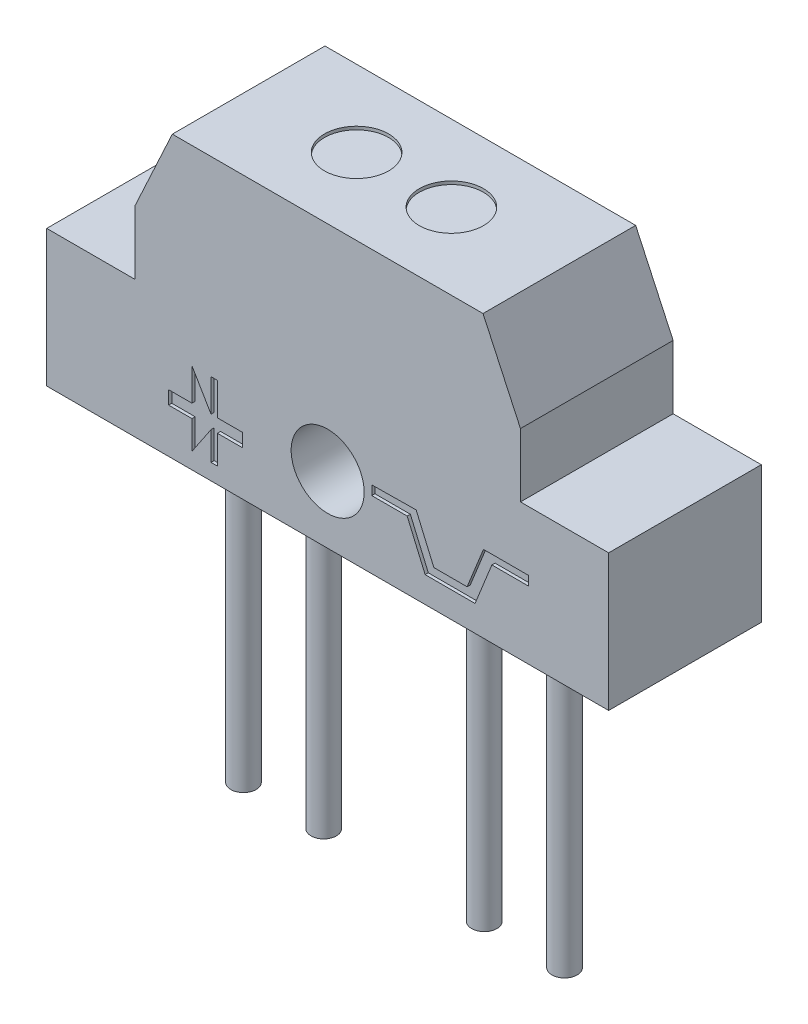
from build123d import *

# Parameters (mm, degrees)
SKETCH_1_W          = 17.78
SKETCH_1_H          = 4.83
EXTRUDE_1_DEPTH     = 4.32
SKETCH_2_W          = 12.2
SKETCH_2_H          = 4.83
EXTRUDE_2_DEPTH     = 2.01
SKETCH_3_W          = 9.83
SKETCH_3_H          = 4.83
EXTRUDE_3_DEPTH     = 2.56
EXTRUDE_4_DEPTH     = 4.83
SKETCH_5_R          = 1.155
CUT_EXTRUDE_1_DEPTH = 14.46822557
CUT_EXTRUDE_2_DEPTH = 0.1
SKETCH_7_R          = 0.4
EXTRUDE_5_DEPTH     = 10.16
SKETCH_8_R          = 1.015
CUT_EXTRUDE_3_DEPTH = 0.1
SKETCH_9_W          = 0.371794872
SKETCH_9_H          = 0.115384615
CUT_EXTRUDE_4_DEPTH = 0.1


with BuildPart() as part:
    # Эскиз1 → Бобышка-Вытянуть1 (new body)
    with BuildSketch(Plane(origin=(0, 0, 0), x_dir=(1, 0, 0), z_dir=(0, 1, 0))):
        Rectangle(SKETCH_1_W, SKETCH_1_H)
    extrude(amount=EXTRUDE_1_DEPTH)

    # Эскиз2 → Бобышка-Вытянуть2 (add)
    with BuildSketch(Plane(origin=(0, 4.32, 0), x_dir=(1, 0, 0), z_dir=(0, 1, 0))):
        Rectangle(SKETCH_2_W, SKETCH_2_H)
    extrude(amount=EXTRUDE_2_DEPTH)

    # Эскиз3 → Бобышка-Вытянуть3 (add)
    with BuildSketch(Plane(origin=(0, 6.33, 0), x_dir=(1, 0, 0), z_dir=(0, 1, 0))):
        Rectangle(SKETCH_3_W, SKETCH_3_H)
    extrude(amount=EXTRUDE_3_DEPTH)

    # Эскиз4 → Бобышка-Вытянуть4 (add)
    with BuildSketch(Plane.XY.offset(2.415)):
        Polygon((-4.915, 8.89), (-6.1, 6.33), (-4.915, 6.33), align=None)
        Polygon((4.915, 8.89), (4.915, 6.33), (6.1, 6.33), align=None)
    extrude(amount=-EXTRUDE_4_DEPTH)

    # Эскиз5 → Вырез-Вытянуть1 (cut, through all)
    with BuildSketch(Plane.XY.offset(2.415)):
        with Locations((0, 2.11)):
            Circle(SKETCH_5_R)
    extrude(amount=-CUT_EXTRUDE_1_DEPTH, mode=Mode.SUBTRACT)

    # Эскиз6 → Вырез-Вытянуть2 (cut)
    with BuildSketch(Plane.XY.offset(2.415)):
        Polygon((-5.030087969, 1.828968487), (-5.030087969, 1.406734825), (-4.295768558, 1.406734825), (-4.295768558, 0.507193546), (-3.689955043, 1.406734825), (-3.689955043, 0.507193546), (-3.488017205, 0.507193546), (-3.488017205, 1.406734825), (-2.698623837, 1.406734825), (-2.698623837, 1.828968487), (-3.488017205, 1.828968487), (-3.488017205, 2.857015663), (-3.689955043, 2.857015663), (-3.689955043, 1.828968487), (-4.295768558, 2.857015663), (-4.295768558, 1.828968487), align=None)
        Polygon((1.395206882, 2.434782002), (1.395206882, 2.141054237), (2.515043985, 2.141054237), (3.084141529, 0.819279296), (4.662928263, 0.819279296), (5.195309837, 2.141054237), (6.35186291, 2.141054237), (6.35186291, 2.434782002), (4.92911905, 2.434782002), (4.411979937, 1.15085041), (3.359511308, 1.15085041), (2.799592757, 2.4513064), align=None)
    extrude(amount=-CUT_EXTRUDE_2_DEPTH, mode=Mode.SUBTRACT)

    # Эскиз7 → Бобышка-Вытянуть5 (add)
    with BuildSketch(Plane.XZ):
        with Locations(Location((5.08, 0, 0), (0, 0, 90))):
            Circle(SKETCH_7_R)
        with Locations(Location((2.54, 0, 0), (0, 0, 90))):
            Circle(SKETCH_7_R)
        with Locations(Location((-5.08, 0, 0), (0, 0, 90))):
            Circle(SKETCH_7_R)
        with Locations(Location((-2.54, 0, 0), (0, 0, 90))):
            Circle(SKETCH_7_R)
    extrude(amount=EXTRUDE_5_DEPTH)

    # Эскиз8 → Вырез-Вытянуть3 (cut)
    with BuildSketch(Plane(origin=(0, 8.89, 0), x_dir=(1, 0, 0), z_dir=(0, 1, 0))):
        with Locations(Location((-1.5, 0, 0), (0, 0, 270))):
            Circle(SKETCH_8_R)
        with Locations(Location((1.5, 0, 0), (0, 0, 270))):
            Circle(SKETCH_8_R)
    extrude(amount=-CUT_EXTRUDE_3_DEPTH, mode=Mode.SUBTRACT)

    # Эскиз9 → Вырез-Вытянуть4 (cut)
    # profile 1 of 11: a face of its own
    with BuildSketch(Plane(origin=(0, 0, -2.415), x_dir=(-1, 0, 0), z_dir=(0, 0, -1))):
        Polygon((-3.957311281, 4.035873106), (-3.957311281, 5.035873106), (-3.81628564, 5.035873106), (-3.81628564, 4.625616695), (-3.329106152, 4.625616695), (-3.329106152, 5.035873106), (-3.188080511, 5.035873106), (-3.188080511, 4.035873106), (-3.329106152, 4.035873106), (-3.329106152, 4.51023208), (-3.81628564, 4.51023208), (-3.81628564, 4.035873106), align=None)
    # profile 2 of 11: a face of its own
    with BuildSketch(Plane(origin=(0, 0, -2.415), x_dir=(-1, 0, 0), z_dir=(0, 0, -1))):
        with BuildLine():
            add(Edge.make_bspline(
                [(-3.008593332, 4.522651952), (-3.00824577, 4.54270109), (-3.007568564, 4.581765819), (-3.001241064, 4.638649098), (-2.990966827, 4.692168822), (-2.976278896, 4.742320823), (-2.957661902, 4.789183688), (-2.935029389, 4.832863532), (-2.907700587, 4.872865931), (-2.876784747, 4.90957168), (-2.842253174, 4.942022253), (-2.805486863, 4.970843011), (-2.766026719, 4.99488293), (-2.724237323, 5.014731978), (-2.679941131, 5.029971502), (-2.633262511, 5.040640556), (-2.584251387, 5.047523132), (-2.550751137, 5.048297789), (-2.533633396, 5.048693619)],
                knots=[0, 0, 0, 0, 1.203621547, 2.345195544, 3.432004029, 4.472479546, 5.478447225, 6.455936844, 7.420185704, 8.381829745, 9.332027588, 10.260832629, 11.182364398, 12.100723901, 13.034044877, 13.989196293, 14.972532542, 16, 16, 16, 16], degree=3))
            add(Edge.make_bspline(
                [(-2.533633396, 5.048693619), (-2.52234307, 5.048496468), (-2.499922523, 5.048104963), (-2.466775747, 5.045126133), (-2.434480726, 5.039809438), (-2.403069263, 5.032684471), (-2.372455856, 5.023336823), (-2.342622223, 5.012302209), (-2.313829525, 4.998628769), (-2.28588621, 4.983319992), (-2.25912213, 4.966196463), (-2.233969315, 4.947280136), (-2.210488013, 4.926714073), (-2.188362807, 4.904836325), (-2.168331984, 4.880908547), (-2.14956802, 4.855659622), (-2.132610108, 4.828641845), (-2.117398078, 4.800076581), (-2.103796977, 4.770405015), (-2.09217221, 4.739504171), (-2.082190235, 4.707744725), (-2.073834479, 4.674938696), (-2.067838999, 4.6410973), (-2.063064734, 4.606366355), (-2.060551906, 4.570632348), (-2.060102793, 4.54649339), (-2.059875383, 4.534270542)],
                knots=[0, 0, 0, 0, 1.034375294, 2.054082248, 3.045783978, 4.031219655, 5.002789406, 5.976610191, 6.94273282, 7.920236376, 8.894345378, 9.851183672, 10.800797181, 11.752517031, 12.698794154, 13.65688337, 14.632873302, 15.61821402, 16.620222298, 17.621258913, 18.640965868, 19.669244166, 20.720417492, 21.788124603, 22.880008887, 24, 24, 24, 24], degree=3))
            add(Edge.make_bspline(
                [(-2.059875383, 4.534270542), (-2.06008374, 4.521846138), (-2.060495385, 4.497299586), (-2.063280744, 4.461036818), (-2.068178372, 4.42581508), (-2.074674242, 4.391529345), (-2.08337851, 4.35825099), (-2.093722194, 4.325884604), (-2.106233465, 4.294622967), (-2.120363557, 4.264390732), (-2.136351749, 4.235603698), (-2.15398781, 4.208463157), (-2.173284234, 4.183222987), (-2.19394791, 4.159573556), (-2.21646139, 4.13793776), (-2.240547451, 4.118113288), (-2.266113483, 4.099913173), (-2.293245373, 4.083830332), (-2.321456204, 4.069733147), (-2.350187728, 4.057226404), (-2.379461287, 4.046560155), (-2.409376928, 4.037916221), (-2.439853046, 4.031384243), (-2.470803876, 4.026493028), (-2.50233088, 4.02367665), (-2.523545218, 4.023261681), (-2.534234358, 4.023052593)],
                knots=[0, 0, 0, 0, 1.141429366, 2.255090526, 3.338676798, 4.407031443, 5.458968682, 6.496860253, 7.526652771, 8.550250826, 9.560787671, 10.54935636, 11.521089193, 12.477323897, 13.431786008, 14.386110112, 15.340986122, 16.312041, 17.28047646, 18.236612773, 19.189437236, 20.140779471, 21.09494583, 22.051062463, 23.018000708, 24, 24, 24, 24], degree=3))
            add(Edge.make_bspline(
                [(-2.534234358, 4.023052593), (-2.545727556, 4.023222636), (-2.568492705, 4.023559449), (-2.602140208, 4.026921419), (-2.634950614, 4.032050221), (-2.666828537, 4.039454662), (-2.697730418, 4.049114278), (-2.72769282, 4.060805972), (-2.756821124, 4.074373487), (-2.784753897, 4.090205307), (-2.811396066, 4.107808588), (-2.836489406, 4.127095826), (-2.860020042, 4.147889273), (-2.881610402, 4.170532617), (-2.901959731, 4.194205031), (-2.920254371, 4.219786402), (-2.937091797, 4.246696572), (-2.951973762, 4.275194943), (-2.965417389, 4.304434652), (-2.976743936, 4.334425052), (-2.986697775, 4.364724163), (-2.994625001, 4.395518738), (-3.000942035, 4.426737739), (-3.005189782, 4.458329221), (-3.008257538, 4.490340231), (-3.008480837, 4.511827177), (-3.008593332, 4.522651952)],
                knots=[0, 0, 0, 0, 1.072727997, 2.12480551, 3.153819198, 4.171534612, 5.177148798, 6.173931848, 7.17235114, 8.174500385, 9.168706755, 10.151274001, 11.127173509, 12.097141049, 13.070188938, 14.039134204, 15.03036519, 16.031505612, 17.038625933, 18.033164522, 19.022845559, 20.014762458, 21.000193215, 21.994692725, 22.989758729, 24, 24, 24, 24], degree=3))
        make_face()
        with BuildLine():
            add(Edge.make_bspline(
                [(-2.867567691, 4.521049388), (-2.867351576, 4.506612199), (-2.866930167, 4.478460701), (-2.862109017, 4.437417313), (-2.854793693, 4.398690787), (-2.84471029, 4.362172407), (-2.831155728, 4.328223335), (-2.814949494, 4.296517353), (-2.79554592, 4.267265225), (-2.773373107, 4.240548781), (-2.748985555, 4.216548729), (-2.722924981, 4.19558596), (-2.695185526, 4.178031125), (-2.666074731, 4.16353586), (-2.635383508, 4.152220984), (-2.603203777, 4.144275964), (-2.569511894, 4.139306998), (-2.546538185, 4.13873075), (-2.534835319, 4.138437208)],
                knots=[0, 0, 0, 0, 1.215430442, 2.370003584, 3.475209778, 4.53279855, 5.55522989, 6.548792651, 7.526809858, 8.505409025, 9.467826767, 10.404123909, 11.316848639, 12.227335424, 13.138360512, 14.065900994, 15.014765094, 16, 16, 16, 16], degree=3))
            add(Edge.make_bspline(
                [(-2.534835319, 4.138437208), (-2.52293409, 4.138735092), (-2.499631516, 4.139318348), (-2.465431682, 4.144200571), (-2.432938011, 4.152512347), (-2.401828433, 4.163577205), (-2.37266538, 4.178535006), (-2.344766809, 4.19605051), (-2.318893241, 4.217453953), (-2.294409552, 4.241496452), (-2.272449333, 4.268825167), (-2.252964261, 4.298766905), (-2.23713596, 4.331770717), (-2.223470358, 4.367109574), (-2.213463617, 4.405451393), (-2.206068022, 4.446360305), (-2.20161128, 4.489967901), (-2.201141963, 4.519903707), (-2.200901024, 4.535272144)],
                knots=[0, 0, 0, 0, 0.976878588, 1.912725521, 2.8289017, 3.727303729, 4.617335839, 5.514666588, 6.426584173, 7.368641557, 8.327632997, 9.299405846, 10.294892156, 11.327373912, 12.405931897, 13.542618837, 14.738430195, 16, 16, 16, 16], degree=3))
            add(Edge.make_bspline(
                [(-2.200901024, 4.535272144), (-2.200986172, 4.545159196), (-2.2011532, 4.564554015), (-2.203365219, 4.5931422), (-2.206218439, 4.620841128), (-2.210562511, 4.647615058), (-2.216549193, 4.673353114), (-2.22318142, 4.69825124), (-2.231474789, 4.722094877), (-2.240884771, 4.74497753), (-2.251414381, 4.766781726), (-2.263290382, 4.787323645), (-2.276374749, 4.806523425), (-2.29031445, 4.824745075), (-2.305881388, 4.841283343), (-2.322326006, 4.856836811), (-2.340021841, 4.871084143), (-2.358792297, 4.884029059), (-2.37837109, 4.895681524), (-2.398717859, 4.905654522), (-2.41950845, 4.914414547), (-2.441090869, 4.921129475), (-2.463167103, 4.926545162), (-2.485826398, 4.930658881), (-2.509152858, 4.932789157), (-2.524882347, 4.933134477), (-2.532832114, 4.933309003)],
                knots=[0, 0, 0, 0, 1.220438779, 2.394059227, 3.538503547, 4.658058814, 5.74010225, 6.800155734, 7.837851593, 8.854470756, 9.853724944, 10.825214244, 11.781044712, 12.72106398, 13.654479919, 14.581868691, 15.514082315, 16.456304431, 17.39516604, 18.324312202, 19.252140633, 20.177768678, 21.111585046, 22.057694709, 23.018348693, 24, 24, 24, 24], degree=3))
            add(Edge.make_bspline(
                [(-2.532832114, 4.933309003), (-2.544068025, 4.933085862), (-2.566237729, 4.932645581), (-2.598874173, 4.927751168), (-2.630339243, 4.920438245), (-2.66068177, 4.91021439), (-2.689642239, 4.8966764), (-2.717370693, 4.880073907), (-2.74411326, 4.860858971), (-2.76944825, 4.838563426), (-2.793066002, 4.812951287), (-2.813032442, 4.78275536), (-2.829860703, 4.748696485), (-2.843911991, 4.710860993), (-2.854625685, 4.668955874), (-2.862030187, 4.623161465), (-2.866705238, 4.57342951), (-2.867272857, 4.538955795), (-2.867567691, 4.521049388)],
                knots=[0, 0, 0, 0, 0.895090134, 1.766112571, 2.624765742, 3.468151641, 4.313618154, 5.168136083, 6.041303099, 6.935189387, 7.854749729, 8.809996334, 9.809869957, 10.877771942, 12.021723904, 13.25217762, 14.572720513, 16, 16, 16, 16], degree=3))
        make_face(mode=Mode.SUBTRACT)
    # profile 3 of 11: a face of its own
    with BuildSketch(Plane(origin=(0, 0, -2.415), x_dir=(-1, 0, 0), z_dir=(0, 0, -1))):
        Polygon((-2.017207114, 4.035873106), (-1.620171858, 5.035873106), (-1.46111737, 5.035873106), (-1.064082114, 4.035873106), (-1.213721537, 4.035873106), (-1.327503588, 4.343565413), (-1.75378564, 4.343565413), (-1.867567691, 4.035873106), align=None)
        with BuildLine():
            Line((-1.711317691, 4.458950029), (-1.369971537, 4.458950029))
            Line((-1.369971537, 4.458950029), (-1.467126986, 4.721770542))
            add(Edge.make_bspline(
                [(-1.467126986, 4.721770542), (-1.470851579, 4.731925568), (-1.478133861, 4.751780562), (-1.488993939, 4.780628193), (-1.49891553, 4.808023086), (-1.508644466, 4.83357244), (-1.51742695, 4.857647384), (-1.52552199, 4.880085302), (-1.533527917, 4.900730241), (-1.538332386, 4.914068998), (-1.540644614, 4.92048849)],
                knots=[0, 0, 0, 0, 1.225184869, 2.395467751, 3.491410812, 4.525364584, 5.492066482, 6.394148129, 7.227157926, 8, 8, 8, 8], degree=3))
            add(Edge.make_bspline(
                [(-1.540644614, 4.92048849), (-1.544469486, 4.904658589), (-1.552135, 4.872933514), (-1.568184721, 4.826452023), (-1.586545045, 4.780395626), (-1.601455815, 4.750717198), (-1.608953909, 4.735792978)],
                knots=[0, 0, 0, 0, 0.9891762, 1.982431084, 2.985436691, 4, 4, 4, 4], degree=3))
            Line((-1.608953909, 4.735792978), (-1.711317691, 4.458950029))
        make_face(mode=Mode.SUBTRACT)
    # profile 4 of 11: a face of its own
    with BuildSketch(Plane(origin=(0, 0, -2.415), x_dir=(-1, 0, 0), z_dir=(0, 0, -1))):
        with BuildLine():
            add(Edge.make_bspline(
                [(-1.008593332, 4.529062208), (-1.008464165, 4.543353126), (-1.008211182, 4.571343016), (-1.00664201, 4.612297254), (-1.003902362, 4.651189797), (-0.999812822, 4.687986871), (-0.99497004, 4.722771532), (-0.988674394, 4.75549414), (-0.981590876, 4.786228113), (-0.973091927, 4.814941416), (-0.963754363, 4.841880931), (-0.953160599, 4.86700344), (-0.941241178, 4.89028231), (-0.928581864, 4.911958953), (-0.914516246, 4.931696209), (-0.899893297, 4.950047987), (-0.883650307, 4.966341255), (-0.866462694, 4.98099524), (-0.848077368, 4.993926527), (-0.828591604, 5.005084669), (-0.808080379, 5.014936504), (-0.78615277, 5.022352962), (-0.763263992, 5.028398948), (-0.739237857, 5.032846448), (-0.714047891, 5.0354684), (-0.69683409, 5.03573668), (-0.688080511, 5.035873106)],
                knots=[0, 0, 0, 0, 1.514747001, 2.966751498, 4.343369068, 5.64627492, 6.890416844, 8.064737671, 9.177176366, 10.232018008, 11.237056675, 12.19799043, 13.119080079, 14.007588942, 14.855863561, 15.685992447, 16.491747269, 17.290132607, 18.077525251, 18.870243746, 19.668095604, 20.485086593, 21.319398728, 22.175900658, 23.072407314, 24, 24, 24, 24], degree=3))
            add(Edge.make_bspline(
                [(-0.688080511, 5.035873106), (-0.675237874, 5.035495541), (-0.650007997, 5.034753801), (-0.613172246, 5.0287043), (-0.578456925, 5.018355696), (-0.545884589, 5.004394982), (-0.516012055, 4.986662189), (-0.489334623, 4.965105278), (-0.466140053, 4.939950591), (-0.446681477, 4.910900055), (-0.429672739, 4.878755076), (-0.414562549, 4.843371376), (-0.400903377, 4.804788608), (-0.391210531, 4.770251643), (-0.384296632, 4.74043811), (-0.37972018, 4.715848751), (-0.375920807, 4.689316695), (-0.373009974, 4.660906129), (-0.370621705, 4.630648918), (-0.368777353, 4.598526224), (-0.367841156, 4.564457762), (-0.367660555, 4.54108191), (-0.367567691, 4.529062208)],
                knots=[0, 0, 0, 0, 1.134486744, 2.228744715, 3.287356444, 4.328707449, 5.352829806, 6.347195599, 7.349461267, 8.364207941, 9.428085653, 10.559314403, 11.761222316, 13.04268526, 13.726896727, 14.465273606, 15.252205015, 16.094778733, 16.988606776, 17.934225168, 18.937792761, 20, 20, 20, 20], degree=3))
            add(Edge.make_bspline(
                [(-0.367567691, 4.529062208), (-0.367699277, 4.514838417), (-0.367956357, 4.487049441), (-0.369483482, 4.446423587), (-0.372388213, 4.407824469), (-0.375962537, 4.371163667), (-0.381369741, 4.336539047), (-0.387196297, 4.3038035), (-0.394402306, 4.273105673), (-0.402810028, 4.244432113), (-0.412279031, 4.217631203), (-0.422663259, 4.192500397), (-0.434164788, 4.169056869), (-0.447125948, 4.147529273), (-0.460953706, 4.127631868), (-0.475749337, 4.109290013), (-0.491826525, 4.092767701), (-0.509169024, 4.07815767), (-0.527425262, 4.064997064), (-0.5469584, 4.053728758), (-0.567682943, 4.044393162), (-0.589460423, 4.036411692), (-0.612511803, 4.030563338), (-0.636655304, 4.026086515), (-0.661979882, 4.023450237), (-0.679260265, 4.02318697), (-0.688080511, 4.023052593)],
                knots=[0, 0, 0, 0, 1.508974709, 2.94807912, 4.311757619, 5.615040294, 6.854280449, 8.028314546, 9.141715822, 10.197470207, 11.196696834, 12.155719058, 13.080757287, 13.963948316, 14.818758719, 15.649605906, 16.461113142, 17.260189315, 18.052359509, 18.845763934, 19.647754795, 20.461145776, 21.303032214, 22.167241874, 23.064524267, 24, 24, 24, 24], degree=3))
            add(Edge.make_bspline(
                [(-0.688080511, 4.023052593), (-0.699644877, 4.023382467), (-0.722192208, 4.024025631), (-0.755120923, 4.028395533), (-0.786026277, 4.036086765), (-0.815168941, 4.046401793), (-0.842221343, 4.060198736), (-0.867312648, 4.076985411), (-0.890947046, 4.096371259), (-0.904552443, 4.111666248), (-0.911437883, 4.11940676)],
                knots=[0, 0, 0, 0, 1.10322584, 2.150986741, 3.161425019, 4.136713905, 5.093944212, 6.049774532, 7.013026876, 8, 8, 8, 8], degree=3))
            add(Edge.make_bspline(
                [(-0.911437883, 4.11940676), (-0.919363183, 4.130839121), (-0.935705491, 4.15441314), (-0.954832746, 4.194609029), (-0.971894595, 4.238859059), (-0.985285019, 4.288031411), (-0.995773059, 4.341734728), (-1.003348042, 4.400074387), (-1.007634737, 4.463025185), (-1.008266587, 4.506552951), (-1.008593332, 4.529062208)],
                knots=[0, 0, 0, 0, 0.779365345, 1.607084704, 2.489375761, 3.438383567, 4.461919411, 5.557722155, 6.737039282, 8, 8, 8, 8], degree=3))
        make_face()
        with BuildLine():
            add(Edge.make_bspline(
                [(-0.880388204, 4.529462849), (-0.880260906, 4.510229212), (-0.880017231, 4.473411776), (-0.877471412, 4.420811717), (-0.873088891, 4.373359283), (-0.867294912, 4.331120177), (-0.859644513, 4.29403726), (-0.850038533, 4.262205033), (-0.839210309, 4.235241435), (-0.825810586, 4.21348066), (-0.81113937, 4.195742454), (-0.795992342, 4.180487023), (-0.780013144, 4.167520257), (-0.763306041, 4.156708617), (-0.745611807, 4.148522755), (-0.727123928, 4.142589623), (-0.707838379, 4.139175197), (-0.694704045, 4.138684608), (-0.688080511, 4.138437208)],
                knots=[0, 0, 0, 0, 1.89448813, 3.626469325, 5.185477471, 6.587276848, 7.82441448, 8.910550357, 9.859733512, 10.6775885, 11.416198291, 12.123144072, 12.791880183, 13.439617036, 14.078171869, 14.70637855, 15.347637704, 16, 16, 16, 16], degree=3))
            add(Edge.make_bspline(
                [(-0.688080511, 4.138437208), (-0.681458637, 4.138690014), (-0.668327591, 4.139191322), (-0.648997482, 4.142530457), (-0.630581534, 4.148769022), (-0.612913683, 4.156925972), (-0.596085147, 4.167491182), (-0.580184428, 4.180506927), (-0.564957609, 4.195753299), (-0.550352295, 4.21369768), (-0.53705466, 4.235559062), (-0.526023311, 4.262500695), (-0.516567035, 4.29438867), (-0.508874657, 4.331452693), (-0.503056777, 4.373625017), (-0.498700753, 4.420945839), (-0.496137897, 4.473478219), (-0.495898243, 4.510229125), (-0.495772819, 4.529462849)],
                knots=[0, 0, 0, 0, 0.652509534, 1.29391342, 1.924290653, 2.562989607, 3.207355802, 3.876242846, 4.583348185, 5.32723334, 6.150888545, 7.094226006, 8.186903555, 9.424320409, 10.81992305, 12.379283064, 14.105084285, 16, 16, 16, 16], degree=3))
            add(Edge.make_bspline(
                [(-0.495772819, 4.529462849), (-0.495894227, 4.548296382), (-0.49612684, 4.584380717), (-0.498755795, 4.635967435), (-0.502875604, 4.682623399), (-0.508510848, 4.724391621), (-0.516000086, 4.761226756), (-0.52508351, 4.793207222), (-0.535907768, 4.820264814), (-0.548777772, 4.842671326), (-0.563104662, 4.861050745), (-0.578070456, 4.876959732), (-0.594049302, 4.890489807), (-0.611324295, 4.901343832), (-0.629338632, 4.910100456), (-0.648506235, 4.916126988), (-0.668638701, 4.9198295), (-0.682455352, 4.920266317), (-0.689482755, 4.92048849)],
                knots=[0, 0, 0, 0, 1.850066095, 3.544656626, 5.0727657, 6.45041401, 7.682899467, 8.762389858, 9.712573485, 10.538438529, 11.291566246, 11.996865408, 12.681389046, 13.341983376, 13.996294293, 14.643563182, 15.31009126, 16, 16, 16, 16], degree=3))
            add(Edge.make_bspline(
                [(-0.689482755, 4.92048849), (-0.696105872, 4.92031466), (-0.709165811, 4.919971888), (-0.728287271, 4.916700134), (-0.746408455, 4.911229033), (-0.763736971, 4.903817895), (-0.779840224, 4.893843966), (-0.795356828, 4.882198695), (-0.809560045, 4.868010233), (-0.818118778, 4.857403159), (-0.822495576, 4.851978875)],
                knots=[0, 0, 0, 0, 1.021318143, 2.013908504, 2.982026795, 3.937174072, 4.91255697, 5.897578595, 6.924855925, 8, 8, 8, 8], degree=3))
            add(Edge.make_bspline(
                [(-0.822495576, 4.851978875), (-0.827260572, 4.844012281), (-0.837323242, 4.827188512), (-0.848582785, 4.797948109), (-0.85852902, 4.764531894), (-0.866718069, 4.726425734), (-0.872642271, 4.683694996), (-0.8773192, 4.636389306), (-0.879748691, 4.584442617), (-0.880169151, 4.548295075), (-0.880388204, 4.529462849)],
                knots=[0, 0, 0, 0, 0.671104906, 1.417232262, 2.260109084, 3.195198885, 4.23592645, 5.382417421, 6.636286093, 8, 8, 8, 8], degree=3))
        make_face(mode=Mode.SUBTRACT)
    # profile 5 of 11: a face of its own
    with BuildSketch(Plane(origin=(0, 0, -2.415), x_dir=(-1, 0, 0), z_dir=(0, 0, -1))):
        with BuildLine():
            Line((0.209355386, 4.035873106), (0.081150258, 4.035873106))
            Line((0.081150258, 4.035873106), (0.081150258, 4.815119901))
            add(Edge.make_bspline(
                [(0.081150258, 4.815119901), (0.073768195, 4.808000809), (0.058425387, 4.793204559), (0.032489991, 4.772264169), (0.003542774, 4.751040196), (-0.028040366, 4.730630974), (-0.060234033, 4.711417892), (-0.091345068, 4.694138679), (-0.120854059, 4.679516272), (-0.14029179, 4.671520682), (-0.149618973, 4.667684003)],
                knots=[0, 0, 0, 0, 0.893362401, 1.856755847, 2.901947673, 4.020460078, 5.132200827, 6.168787962, 7.121294059, 8, 8, 8, 8], degree=3))
            Line((-0.149618973, 4.667684003), (-0.149618973, 4.785873106))
            add(Edge.make_bspline(
                [(-0.149618973, 4.785873106), (-0.133598572, 4.794123644), (-0.102023311, 4.810384967), (-0.057414294, 4.838470507), (-0.015766978, 4.868916389), (0.022229209, 4.901715871), (0.056290369, 4.93524283), (0.084994203, 4.969072849), (0.109011745, 5.001965864), (0.121061801, 5.024905095), (0.126823335, 5.035873106)],
                knots=[0, 0, 0, 0, 1.141258006, 2.249351951, 3.335817539, 4.406819942, 5.426913362, 6.360259544, 7.215985427, 8, 8, 8, 8], degree=3))
            Line((0.126823335, 5.035873106), (0.209355386, 5.035873106))
            Line((0.209355386, 5.035873106), (0.209355386, 4.035873106))
        make_face()
    # profile 6 of 11: a face of its own
    with BuildSketch(Plane(origin=(0, 0, -2.415), x_dir=(-1, 0, 0), z_dir=(0, 0, -1))):
        Polygon((0.914483591, 4.035873106), (0.914483591, 4.279462849), (0.478586155, 4.279462849), (0.478586155, 4.407667978), (0.95294513, 5.023052593), (1.042688719, 5.023052593), (1.042688719, 4.407667978), (1.170893848, 4.407667978), (1.170893848, 4.279462849), (1.042688719, 4.279462849), (1.042688719, 4.035873106), align=None)
        Polygon((0.914483591, 4.407667978), (0.914483591, 4.76784426), (0.63683936, 4.407667978), align=None, mode=Mode.SUBTRACT)
    # profile 7 of 11: a face of its own
    with BuildSketch(Plane(origin=(0, 0, -2.415), x_dir=(-1, 0, 0), z_dir=(0, 0, -1))):
        with BuildLine():
            Line((1.311919489, 4.279462849), (1.440124617, 4.292283362))
            add(Edge.make_bspline(
                [(1.440124617, 4.292283362), (1.441283668, 4.285714636), (1.443524211, 4.273016731), (1.448580412, 4.254920041), (1.45370864, 4.23804663), (1.460328491, 4.222772397), (1.467222584, 4.208682452), (1.475029954, 4.195917987), (1.483889704, 4.184735372), (1.496400834, 4.171631341), (1.514152307, 4.157957062), (1.538758253, 4.146880363), (1.565827105, 4.139432717), (1.584903192, 4.13877663), (1.594772053, 4.138437208)],
                knots=[0, 0, 0, 0, 0.994516507, 1.922484754, 2.80151264, 3.623050913, 4.402748861, 5.140924173, 5.850441436, 6.526872911, 7.841975818, 9.161260782, 10.53140107, 12, 12, 12, 12], degree=3))
            add(Edge.make_bspline(
                [(1.594772053, 4.138437208), (1.603407402, 4.138748175), (1.620403107, 4.139360206), (1.645183407, 4.144104717), (1.668749089, 4.151705325), (1.690689937, 4.162610606), (1.710926099, 4.175882029), (1.728601704, 4.191651152), (1.743952777, 4.209238819), (1.756560776, 4.229503187), (1.767322044, 4.252648496), (1.77749001, 4.278969106), (1.787108738, 4.308918477), (1.795657298, 4.342114614), (1.803312115, 4.377345587), (1.808684191, 4.413813099), (1.811989421, 4.450808165), (1.812343005, 4.4757033), (1.81252045, 4.488196824)],
                knots=[0, 0, 0, 0, 0.897794352, 1.766998465, 2.614902619, 3.466100941, 4.308008728, 5.124841802, 5.922729683, 6.728261092, 7.598214292, 8.574707161, 9.662086263, 10.868425066, 12.139522319, 13.41071447, 14.70057738, 16, 16, 16, 16], degree=3))
            add(Edge.make_bspline(
                [(1.81252045, 4.488196824), (1.812459766, 4.491602418), (1.812314581, 4.499750102), (1.812064841, 4.507895289), (1.811919489, 4.512635926)],
                knots=[0, 0, 0, 0, 0.835966126, 2, 2, 2, 2], degree=3))
            add(Edge.make_bspline(
                [(1.811919489, 4.512635926), (1.805738923, 4.503250288), (1.79338775, 4.484494135), (1.770633839, 4.459321108), (1.744602966, 4.43699229), (1.71569026, 4.417681069), (1.684609644, 4.401832733), (1.651901824, 4.39031669), (1.617848754, 4.383205685), (1.59467278, 4.382422828), (1.582953142, 4.382026952)],
                knots=[0, 0, 0, 0, 0.978840568, 1.956103883, 2.947027447, 3.962820877, 4.980997961, 5.980964245, 6.979013046, 8, 8, 8, 8], degree=3))
            add(Edge.make_bspline(
                [(1.582953142, 4.382026952), (1.573186739, 4.382279989), (1.553961385, 4.382778096), (1.525799625, 4.387205121), (1.498713532, 4.393844088), (1.472959776, 4.403895805), (1.448137666, 4.416327193), (1.424507834, 4.431585769), (1.402033868, 4.449650763), (1.381006169, 4.470297236), (1.361816543, 4.493310433), (1.344893508, 4.518129707), (1.330840642, 4.544876418), (1.319148172, 4.573216727), (1.3101262, 4.60342446), (1.303857111, 4.635428837), (1.299640847, 4.669107688), (1.299281995, 4.692176554), (1.299098976, 4.703942016)],
                knots=[0, 0, 0, 0, 0.975490236, 1.920271282, 2.842894855, 3.757591483, 4.67685385, 5.613562631, 6.563069669, 7.554119451, 8.55387214, 9.553424333, 10.550567425, 11.568071726, 12.613215376, 13.695622473, 14.824733476, 16, 16, 16, 16], degree=3))
            add(Edge.make_bspline(
                [(1.299098976, 4.703942016), (1.299373091, 4.716106027), (1.299909309, 4.739900942), (1.30395979, 4.774692063), (1.310660943, 4.807652321), (1.320433651, 4.838718803), (1.332519223, 4.86809112), (1.34775866, 4.895557502), (1.365565155, 4.921235445), (1.386045099, 4.94487739), (1.408552371, 4.966090758), (1.432448579, 4.985024058), (1.458045108, 5.000587141), (1.484851167, 5.013562869), (1.513069618, 5.023590708), (1.54265223, 5.030838728), (1.573680864, 5.03509164), (1.594825692, 5.035609494), (1.60558936, 5.035873106)],
                knots=[0, 0, 0, 0, 1.151671969, 2.252870106, 3.311924673, 4.331900944, 5.332425074, 6.314476151, 7.300265758, 8.286521684, 9.270545387, 10.225535917, 11.167946231, 12.101233205, 13.04124339, 13.998220545, 14.981004193, 16, 16, 16, 16], degree=3))
            add(Edge.make_bspline(
                [(1.60558936, 5.035873106), (1.613406885, 5.035714999), (1.628945511, 5.035400735), (1.652070211, 5.033001436), (1.674647322, 5.028676308), (1.696824043, 5.023216779), (1.718226315, 5.015638542), (1.739266701, 5.006875087), (1.759691421, 4.996156719), (1.779619489, 4.983968591), (1.798925741, 4.970524947), (1.816688606, 4.955079656), (1.833618055, 4.93868858), (1.849369597, 4.920837291), (1.863445011, 4.901250285), (1.876799872, 4.88062006), (1.888790411, 4.858496456), (1.899724949, 4.834849511), (1.909457113, 4.809192461), (1.917576175, 4.78095831), (1.924536023, 4.750049269), (1.930330783, 4.716424366), (1.934627692, 4.680107575), (1.937789966, 4.641152867), (1.939860171, 4.599530615), (1.940034736, 4.570865004), (1.940124617, 4.556105478)],
                knots=[0, 0, 0, 0, 0.850689348, 1.69088598, 2.526071361, 3.350886897, 4.173587108, 4.994166539, 5.82944675, 6.680632524, 7.535501428, 8.385942454, 9.238956306, 10.098905971, 10.972410977, 11.861345628, 12.77184846, 13.708225841, 14.694799433, 15.754852217, 16.902446579, 18.141290626, 19.466225842, 20.880733292, 22.39393263, 24, 24, 24, 24], degree=3))
            add(Edge.make_bspline(
                [(1.940124617, 4.556105478), (1.940034134, 4.54067832), (1.939857787, 4.510611412), (1.93777133, 4.466721355), (1.934610646, 4.42523215), (1.9303107, 4.38611655), (1.924475544, 4.349434253), (1.917539997, 4.315191673), (1.909360701, 4.283325591), (1.899748837, 4.253833211), (1.888822005, 4.226375604), (1.876849425, 4.200614671), (1.863440798, 4.176588507), (1.848746785, 4.154251035), (1.832956064, 4.133563213), (1.815822091, 4.11458046), (1.7973393, 4.097360158), (1.777743288, 4.081708509), (1.757063464, 4.067915476), (1.735581352, 4.055744839), (1.713054513, 4.045774958), (1.68971453, 4.037596026), (1.665602877, 4.03084299), (1.640523162, 4.026292782), (1.614591252, 4.0237157), (1.597047975, 4.02327555), (1.588161476, 4.023052593)],
                knots=[0, 0, 0, 0, 1.538356107, 2.998194159, 4.380716326, 5.687456969, 6.921258146, 8.08355215, 9.170518603, 10.200253214, 11.174652363, 12.115998813, 13.031191965, 13.915860606, 14.780247615, 15.624154577, 16.462764255, 17.29681422, 18.1223677, 18.939254916, 19.756006416, 20.575278551, 21.404021733, 22.250368457, 23.113728878, 24, 24, 24, 24], degree=3))
            add(Edge.make_bspline(
                [(1.588161476, 4.023052593), (1.578735787, 4.023215564), (1.56029439, 4.023534417), (1.533371847, 4.026887182), (1.50772455, 4.031984478), (1.483427143, 4.039509294), (1.460297661, 4.04877214), (1.438730878, 4.06060953), (1.418343527, 4.074266337), (1.399387122, 4.090017962), (1.38208362, 4.10780656), (1.366427257, 4.127193725), (1.352701239, 4.148430554), (1.340977399, 4.171391841), (1.330592797, 4.195884411), (1.322541907, 4.222236694), (1.316001332, 4.250205645), (1.313302075, 4.269552963), (1.311919489, 4.279462849)],
                knots=[0, 0, 0, 0, 1.08199657, 2.11693069, 3.111083497, 4.081436044, 5.034173265, 5.967546613, 6.901297947, 7.84883568, 8.792454994, 9.747011506, 10.706361727, 11.690764787, 12.70483191, 13.757514363, 14.851376857, 16, 16, 16, 16], degree=3))
        make_face()
        with BuildLine():
            add(Edge.make_bspline(
                [(1.811919489, 4.706746503), (1.811775297, 4.714765685), (1.811494638, 4.730374509), (1.809035722, 4.753147588), (1.805079342, 4.774593064), (1.79952627, 4.794834251), (1.791985034, 4.813656586), (1.783249027, 4.831499519), (1.772565768, 4.847868497), (1.760511587, 4.862983941), (1.747233663, 4.876504357), (1.732774126, 4.888292951), (1.717404082, 4.898398448), (1.700754801, 4.906344086), (1.683373598, 4.912891264), (1.664842954, 4.917170244), (1.645417847, 4.920167756), (1.632043885, 4.920380138), (1.625220771, 4.92048849)],
                knots=[0, 0, 0, 0, 1.20361398, 2.342757417, 3.433960756, 4.474970456, 5.487648377, 6.473933575, 7.452701285, 8.415527761, 9.372491588, 10.291530068, 11.211879743, 12.12647906, 13.055739058, 13.994253148, 14.97671008, 16, 16, 16, 16], degree=3))
            add(Edge.make_bspline(
                [(1.625220771, 4.92048849), (1.61820257, 4.92027582), (1.604376697, 4.919856858), (1.584112129, 4.917158727), (1.564893684, 4.911992637), (1.546591615, 4.905139936), (1.529002649, 4.896663266), (1.512766218, 4.885556236), (1.497202281, 4.872969219), (1.482935084, 4.858366603), (1.469902469, 4.842356412), (1.4584193, 4.82508892), (1.448749016, 4.806555666), (1.441018831, 4.786833922), (1.434701483, 4.766095583), (1.430361914, 4.744155216), (1.427691715, 4.721036178), (1.427435233, 4.705218233), (1.427304104, 4.697131119)],
                knots=[0, 0, 0, 0, 1.007165334, 1.984118292, 2.925321257, 3.856078893, 4.785899085, 5.718627206, 6.671847665, 7.654235469, 8.641842333, 9.630378272, 10.624608936, 11.635186472, 12.665777387, 13.731187195, 14.840042241, 16, 16, 16, 16], degree=3))
            add(Edge.make_bspline(
                [(1.427304104, 4.697131119), (1.427425212, 4.689909049), (1.427662657, 4.675749377), (1.430490371, 4.655084626), (1.434262122, 4.635362009), (1.440275005, 4.616782844), (1.447518783, 4.599077397), (1.456933466, 4.582652301), (1.467533503, 4.567016412), (1.479953498, 4.552693536), (1.49368383, 4.539700176), (1.508680139, 4.528375064), (1.524753007, 4.518680572), (1.542051757, 4.51087788), (1.560472651, 4.504868659), (1.57997457, 4.50044466), (1.600642285, 4.497809617), (1.614796404, 4.497546016), (1.622015642, 4.497411567)],
                knots=[0, 0, 0, 0, 1.102204012, 2.160993585, 3.181057555, 4.164839289, 5.138418409, 6.097303793, 7.050641095, 8.019669129, 8.986440483, 9.932879371, 10.884360123, 11.847412593, 12.824617322, 13.839006415, 14.897795988, 16, 16, 16, 16], degree=3))
            add(Edge.make_bspline(
                [(1.622015642, 4.497411567), (1.628767966, 4.49754733), (1.642058048, 4.49781454), (1.661526623, 4.500460817), (1.680025429, 4.50489302), (1.697637523, 4.510918787), (1.71433436, 4.518718781), (1.730003662, 4.528490313), (1.744948329, 4.539686009), (1.758730276, 4.552767633), (1.771326471, 4.567251549), (1.782219838, 4.583280845), (1.791522188, 4.600564425), (1.798844085, 4.619307156), (1.804708577, 4.639278283), (1.808837569, 4.660604246), (1.811541573, 4.683239519), (1.811791612, 4.698792334), (1.811919489, 4.706746503)],
                knots=[0, 0, 0, 0, 1.017004716, 2.00169281, 2.953445817, 3.879374072, 4.80207141, 5.723561102, 6.657273834, 7.611045633, 8.581233951, 9.544037932, 10.525327521, 11.53237926, 12.57032081, 13.657564536, 14.802009319, 16, 16, 16, 16], degree=3))
        make_face(mode=Mode.SUBTRACT)
    # profile 8 of 11: a face of its own
    with BuildSketch(Plane(origin=(0, 0, -2.415), x_dir=(-1, 0, 0), z_dir=(0, 0, -1))):
        with Locations((2.228586155, 4.388437209)):
            Rectangle(SKETCH_9_W, SKETCH_9_H)
    # profile 9 of 11: a face of its own
    with BuildSketch(Plane(origin=(0, 0, -2.415), x_dir=(-1, 0, 0), z_dir=(0, 0, -1))):
        with BuildLine():
            add(Edge.make_bspline(
                [(2.529868207, 4.529062208), (2.529997373, 4.543353126), (2.530250356, 4.571343016), (2.531819529, 4.612297254), (2.534559177, 4.651189797), (2.538648717, 4.687986871), (2.543491498, 4.722771532), (2.549787144, 4.75549414), (2.556870662, 4.786228113), (2.565369612, 4.814941416), (2.574707176, 4.841880931), (2.585300939, 4.86700344), (2.597220361, 4.89028231), (2.609879674, 4.911958953), (2.623945292, 4.931696209), (2.638568242, 4.950047987), (2.654811232, 4.966341255), (2.671998844, 4.98099524), (2.69038417, 4.993926527), (2.709869934, 5.005084669), (2.73038116, 5.014936504), (2.752308768, 5.022352962), (2.775197547, 5.028398948), (2.799223681, 5.032846448), (2.824413648, 5.0354684), (2.841627449, 5.03573668), (2.850381027, 5.035873106)],
                knots=[0, 0, 0, 0, 1.514747001, 2.966751498, 4.343369068, 5.64627492, 6.890416844, 8.064737671, 9.177176366, 10.232018008, 11.237056675, 12.19799043, 13.119080079, 14.007588942, 14.855863561, 15.685992447, 16.491747269, 17.290132607, 18.077525251, 18.870243746, 19.668095604, 20.485086593, 21.319398728, 22.175900658, 23.072407314, 24, 24, 24, 24], degree=3))
            add(Edge.make_bspline(
                [(2.850381027, 5.035873106), (2.863223665, 5.035495541), (2.888453542, 5.034753801), (2.925289292, 5.0287043), (2.960004613, 5.018355696), (2.99257695, 5.004394982), (3.022449483, 4.986662189), (3.049126915, 4.965105278), (3.072321485, 4.939950591), (3.091780062, 4.910900055), (3.1087888, 4.878755076), (3.123898989, 4.843371376), (3.137558162, 4.804788608), (3.147251008, 4.770251643), (3.154164907, 4.74043811), (3.158741359, 4.715848751), (3.162540731, 4.689316695), (3.165451564, 4.660906129), (3.167839834, 4.630648918), (3.169684185, 4.598526224), (3.170620382, 4.564457762), (3.170800984, 4.54108191), (3.170893848, 4.529062208)],
                knots=[0, 0, 0, 0, 1.134486744, 2.228744715, 3.287356444, 4.328707449, 5.352829806, 6.347195599, 7.349461267, 8.364207941, 9.428085653, 10.559314403, 11.761222316, 13.04268526, 13.726896727, 14.465273606, 15.252205015, 16.094778733, 16.988606776, 17.934225168, 18.937792761, 20, 20, 20, 20], degree=3))
            add(Edge.make_bspline(
                [(3.170893848, 4.529062208), (3.170762261, 4.514838417), (3.170505182, 4.487049441), (3.168978056, 4.446423587), (3.166073325, 4.407824469), (3.162499001, 4.371163667), (3.157091797, 4.336539047), (3.151265242, 4.3038035), (3.144059232, 4.273105673), (3.135651511, 4.244432113), (3.126182507, 4.217631203), (3.11579828, 4.192500397), (3.10429675, 4.169056869), (3.091335591, 4.147529273), (3.077507832, 4.127631868), (3.062712202, 4.109290013), (3.046635014, 4.092767701), (3.029292515, 4.07815767), (3.011036276, 4.064997064), (2.991503139, 4.053728758), (2.970778596, 4.044393162), (2.949001116, 4.036411692), (2.925949735, 4.030563338), (2.901806234, 4.026086515), (2.876481657, 4.023450237), (2.859201274, 4.02318697), (2.850381027, 4.023052593)],
                knots=[0, 0, 0, 0, 1.508974709, 2.94807912, 4.311757619, 5.615040294, 6.854280449, 8.028314546, 9.141715822, 10.197470207, 11.196696834, 12.155719058, 13.080757287, 13.963948316, 14.818758719, 15.649605906, 16.461113142, 17.260189315, 18.052359509, 18.845763934, 19.647754795, 20.461145776, 21.303032214, 22.167241874, 23.064524267, 24, 24, 24, 24], degree=3))
            add(Edge.make_bspline(
                [(2.850381027, 4.023052593), (2.838816661, 4.023382467), (2.81626933, 4.024025631), (2.783340616, 4.028395533), (2.752435261, 4.036086765), (2.723292597, 4.046401793), (2.696240195, 4.060198736), (2.671148891, 4.076985411), (2.647514492, 4.096371259), (2.633909095, 4.111666248), (2.627023655, 4.11940676)],
                knots=[0, 0, 0, 0, 1.10322584, 2.150986741, 3.161425019, 4.136713905, 5.093944212, 6.049774532, 7.013026876, 8, 8, 8, 8], degree=3))
            add(Edge.make_bspline(
                [(2.627023655, 4.11940676), (2.619098355, 4.130839121), (2.602756047, 4.15441314), (2.583628793, 4.194609029), (2.566566943, 4.238859059), (2.553176519, 4.288031411), (2.54268848, 4.341734728), (2.535113496, 4.400074387), (2.530826802, 4.463025185), (2.530194952, 4.506552951), (2.529868207, 4.529062208)],
                knots=[0, 0, 0, 0, 0.779365345, 1.607084704, 2.489375761, 3.438383567, 4.461919411, 5.557722155, 6.737039282, 8, 8, 8, 8], degree=3))
        make_face()
        with BuildLine():
            add(Edge.make_bspline(
                [(2.658073335, 4.529462849), (2.658200632, 4.510229212), (2.658444308, 4.473411776), (2.660990126, 4.420811717), (2.665372647, 4.373359283), (2.671166627, 4.331120177), (2.678817025, 4.29403726), (2.688423005, 4.262205033), (2.69925123, 4.235241435), (2.712650952, 4.21348066), (2.727322169, 4.195742454), (2.742469197, 4.180487023), (2.758448394, 4.167520257), (2.775155498, 4.156708617), (2.792849731, 4.148522755), (2.811337611, 4.142589623), (2.830623159, 4.139175197), (2.843757494, 4.138684608), (2.850381027, 4.138437208)],
                knots=[0, 0, 0, 0, 1.89448813, 3.626469325, 5.185477471, 6.587276848, 7.82441448, 8.910550357, 9.859733512, 10.6775885, 11.416198291, 12.123144072, 12.791880183, 13.439617036, 14.078171869, 14.70637855, 15.347637704, 16, 16, 16, 16], degree=3))
            add(Edge.make_bspline(
                [(2.850381027, 4.138437208), (2.857002902, 4.138690014), (2.870133947, 4.139191322), (2.889464057, 4.142530457), (2.907880004, 4.148769022), (2.925547855, 4.156925972), (2.942376392, 4.167491182), (2.95827711, 4.180506927), (2.97350393, 4.195753299), (2.988109243, 4.21369768), (3.001406879, 4.235559062), (3.012438227, 4.262500695), (3.021894504, 4.29438867), (3.029586882, 4.331452693), (3.035404762, 4.373625017), (3.039760786, 4.420945839), (3.042323641, 4.473478219), (3.042563295, 4.510229125), (3.042688719, 4.529462849)],
                knots=[0, 0, 0, 0, 0.652509534, 1.29391342, 1.924290653, 2.562989607, 3.207355802, 3.876242846, 4.583348185, 5.32723334, 6.150888545, 7.094226006, 8.186903555, 9.424320409, 10.81992305, 12.379283064, 14.105084285, 16, 16, 16, 16], degree=3))
            add(Edge.make_bspline(
                [(3.042688719, 4.529462849), (3.042567311, 4.548296382), (3.042334698, 4.584380717), (3.039705743, 4.635967435), (3.035585935, 4.682623399), (3.029950691, 4.724391621), (3.022461453, 4.761226756), (3.013378029, 4.793207222), (3.002553771, 4.820264814), (2.989683766, 4.842671326), (2.975356877, 4.861050745), (2.960391082, 4.876959732), (2.944412237, 4.890489807), (2.927137243, 4.901343832), (2.909122907, 4.910100456), (2.889955304, 4.916126988), (2.869822837, 4.9198295), (2.856006186, 4.920266317), (2.848978783, 4.92048849)],
                knots=[0, 0, 0, 0, 1.850066095, 3.544656626, 5.0727657, 6.45041401, 7.682899467, 8.762389858, 9.712573485, 10.538438529, 11.291566246, 11.996865408, 12.681389046, 13.341983376, 13.996294293, 14.643563182, 15.31009126, 16, 16, 16, 16], degree=3))
            add(Edge.make_bspline(
                [(2.848978783, 4.92048849), (2.842355666, 4.92031466), (2.829295728, 4.919971888), (2.810174267, 4.916700134), (2.792053084, 4.911229033), (2.774724567, 4.903817895), (2.758621314, 4.893843966), (2.743104711, 4.882198695), (2.728901494, 4.868010233), (2.72034276, 4.857403159), (2.715965963, 4.851978875)],
                knots=[0, 0, 0, 0, 1.021318143, 2.013908504, 2.982026795, 3.937174072, 4.91255697, 5.897578595, 6.924855925, 8, 8, 8, 8], degree=3))
            add(Edge.make_bspline(
                [(2.715965963, 4.851978875), (2.711200966, 4.844012281), (2.701138296, 4.827188512), (2.689878753, 4.797948109), (2.679932518, 4.764531894), (2.67174347, 4.726425734), (2.665819267, 4.683694996), (2.661142338, 4.636389306), (2.658712848, 4.584442617), (2.658292387, 4.548295075), (2.658073335, 4.529462849)],
                knots=[0, 0, 0, 0, 0.671104906, 1.417232262, 2.260109084, 3.195198885, 4.23592645, 5.382417421, 6.636286093, 8, 8, 8, 8], degree=3))
        make_face(mode=Mode.SUBTRACT)
    # profile 10 of 11: a face of its own
    with BuildSketch(Plane(origin=(0, 0, -2.415), x_dir=(-1, 0, 0), z_dir=(0, 0, -1))):
        with BuildLine():
            add(Edge.make_bspline(
                [(3.299098976, 4.529062208), (3.299228142, 4.543353126), (3.299481126, 4.571343016), (3.301050298, 4.612297254), (3.303789946, 4.651189797), (3.307879486, 4.687986871), (3.312722267, 4.722771532), (3.319017914, 4.75549414), (3.326101431, 4.786228113), (3.334600381, 4.814941416), (3.343937945, 4.841880931), (3.354531709, 4.86700344), (3.36645113, 4.89028231), (3.379110444, 4.911958953), (3.393176061, 4.931696209), (3.407799011, 4.950047987), (3.424042001, 4.966341255), (3.441229613, 4.98099524), (3.45961494, 4.993926527), (3.479100704, 5.005084669), (3.499611929, 5.014936504), (3.521539538, 5.022352962), (3.544428316, 5.028398948), (3.56845445, 5.032846448), (3.593644417, 5.0354684), (3.610858218, 5.03573668), (3.619611796, 5.035873106)],
                knots=[0, 0, 0, 0, 1.514747001, 2.966751498, 4.343369068, 5.64627492, 6.890416844, 8.064737671, 9.177176366, 10.232018008, 11.237056675, 12.19799043, 13.119080079, 14.007588942, 14.855863561, 15.685992447, 16.491747269, 17.290132607, 18.077525251, 18.870243746, 19.668095604, 20.485086593, 21.319398728, 22.175900658, 23.072407314, 24, 24, 24, 24], degree=3))
            add(Edge.make_bspline(
                [(3.619611796, 5.035873106), (3.632454434, 5.035495541), (3.657684311, 5.034753801), (3.694520061, 5.0287043), (3.729235382, 5.018355696), (3.761807719, 5.004394982), (3.791680253, 4.986662189), (3.818357684, 4.965105278), (3.841552255, 4.939950591), (3.861010831, 4.910900055), (3.878019569, 4.878755076), (3.893129758, 4.843371376), (3.906788931, 4.804788608), (3.916481777, 4.770251643), (3.923395676, 4.74043811), (3.927972128, 4.715848751), (3.931771501, 4.689316695), (3.934682333, 4.660906129), (3.937070603, 4.630648918), (3.938914954, 4.598526224), (3.939851151, 4.564457762), (3.940031753, 4.54108191), (3.940124617, 4.529062208)],
                knots=[0, 0, 0, 0, 1.134486744, 2.228744715, 3.287356444, 4.328707449, 5.352829806, 6.347195599, 7.349461267, 8.364207941, 9.428085653, 10.559314403, 11.761222316, 13.04268526, 13.726896727, 14.465273606, 15.252205015, 16.094778733, 16.988606776, 17.934225168, 18.937792761, 20, 20, 20, 20], degree=3))
            add(Edge.make_bspline(
                [(3.940124617, 4.529062208), (3.939993031, 4.514838417), (3.939735951, 4.487049441), (3.938208825, 4.446423587), (3.935304095, 4.407824469), (3.93172977, 4.371163667), (3.926322566, 4.336539047), (3.920496011, 4.3038035), (3.913290001, 4.273105673), (3.90488228, 4.244432113), (3.895413276, 4.217631203), (3.885029049, 4.192500397), (3.87352752, 4.169056869), (3.86056636, 4.147529273), (3.846738602, 4.127631868), (3.831942971, 4.109290013), (3.815865783, 4.092767701), (3.798523284, 4.07815767), (3.780267045, 4.064997064), (3.760733908, 4.053728758), (3.740009365, 4.044393162), (3.718231885, 4.036411692), (3.695180504, 4.030563338), (3.671037004, 4.026086515), (3.645712426, 4.023450237), (3.628432043, 4.02318697), (3.619611796, 4.023052593)],
                knots=[0, 0, 0, 0, 1.508974709, 2.94807912, 4.311757619, 5.615040294, 6.854280449, 8.028314546, 9.141715822, 10.197470207, 11.196696834, 12.155719058, 13.080757287, 13.963948316, 14.818758719, 15.649605906, 16.461113142, 17.260189315, 18.052359509, 18.845763934, 19.647754795, 20.461145776, 21.303032214, 22.167241874, 23.064524267, 24, 24, 24, 24], degree=3))
            add(Edge.make_bspline(
                [(3.619611796, 4.023052593), (3.60804743, 4.023382467), (3.585500099, 4.024025631), (3.552571385, 4.028395533), (3.52166603, 4.036086765), (3.492523366, 4.046401793), (3.465470964, 4.060198736), (3.44037966, 4.076985411), (3.416745261, 4.096371259), (3.403139865, 4.111666248), (3.396254424, 4.11940676)],
                knots=[0, 0, 0, 0, 1.10322584, 2.150986741, 3.161425019, 4.136713905, 5.093944212, 6.049774532, 7.013026876, 8, 8, 8, 8], degree=3))
            add(Edge.make_bspline(
                [(3.396254424, 4.11940676), (3.388329124, 4.130839121), (3.371986817, 4.15441314), (3.352859562, 4.194609029), (3.335797712, 4.238859059), (3.322407289, 4.288031411), (3.311919249, 4.341734728), (3.304344266, 4.400074387), (3.300057571, 4.463025185), (3.299425721, 4.506552951), (3.299098976, 4.529062208)],
                knots=[0, 0, 0, 0, 0.779365345, 1.607084704, 2.489375761, 3.438383567, 4.461919411, 5.557722155, 6.737039282, 8, 8, 8, 8], degree=3))
        make_face()
        with BuildLine():
            add(Edge.make_bspline(
                [(3.427304104, 4.529462849), (3.427431401, 4.510229212), (3.427675077, 4.473411776), (3.430220895, 4.420811717), (3.434603416, 4.373359283), (3.440397396, 4.331120177), (3.448047794, 4.29403726), (3.457653775, 4.262205033), (3.468481999, 4.235241435), (3.481881722, 4.21348066), (3.496552938, 4.195742454), (3.511699966, 4.180487023), (3.527679163, 4.167520257), (3.544386267, 4.156708617), (3.562080501, 4.148522755), (3.58056838, 4.142589623), (3.599853928, 4.139175197), (3.612988263, 4.138684608), (3.619611796, 4.138437208)],
                knots=[0, 0, 0, 0, 1.89448813, 3.626469325, 5.185477471, 6.587276848, 7.82441448, 8.910550357, 9.859733512, 10.6775885, 11.416198291, 12.123144072, 12.791880183, 13.439617036, 14.078171869, 14.70637855, 15.347637704, 16, 16, 16, 16], degree=3))
            add(Edge.make_bspline(
                [(3.619611796, 4.138437208), (3.626233671, 4.138690014), (3.639364717, 4.139191322), (3.658694826, 4.142530457), (3.677110773, 4.148769022), (3.694778625, 4.156925972), (3.711607161, 4.167491182), (3.727507879, 4.180506927), (3.742734699, 4.195753299), (3.757340013, 4.21369768), (3.770637648, 4.235559062), (3.781668997, 4.262500695), (3.791125273, 4.29438867), (3.798817651, 4.331452693), (3.804635531, 4.373625017), (3.808991555, 4.420945839), (3.811554411, 4.473478219), (3.811794065, 4.510229125), (3.811919489, 4.529462849)],
                knots=[0, 0, 0, 0, 0.652509534, 1.29391342, 1.924290653, 2.562989607, 3.207355802, 3.876242846, 4.583348185, 5.32723334, 6.150888545, 7.094226006, 8.186903555, 9.424320409, 10.81992305, 12.379283064, 14.105084285, 16, 16, 16, 16], degree=3))
            add(Edge.make_bspline(
                [(3.811919489, 4.529462849), (3.811798081, 4.548296382), (3.811565467, 4.584380717), (3.808936512, 4.635967435), (3.804816704, 4.682623399), (3.79918146, 4.724391621), (3.791692222, 4.761226756), (3.782608798, 4.793207222), (3.77178454, 4.820264814), (3.758914536, 4.842671326), (3.744587646, 4.861050745), (3.729621852, 4.876959732), (3.713643006, 4.890489807), (3.696368012, 4.901343832), (3.678353676, 4.910100456), (3.659186073, 4.916126988), (3.639053606, 4.9198295), (3.625236956, 4.920266317), (3.618209553, 4.92048849)],
                knots=[0, 0, 0, 0, 1.850066095, 3.544656626, 5.0727657, 6.45041401, 7.682899467, 8.762389858, 9.712573485, 10.538438529, 11.291566246, 11.996865408, 12.681389046, 13.341983376, 13.996294293, 14.643563182, 15.31009126, 16, 16, 16, 16], degree=3))
            add(Edge.make_bspline(
                [(3.618209553, 4.92048849), (3.611586435, 4.92031466), (3.598526497, 4.919971888), (3.579405036, 4.916700134), (3.561283853, 4.911229033), (3.543955336, 4.903817895), (3.527852084, 4.893843966), (3.51233548, 4.882198695), (3.498132263, 4.868010233), (3.489573529, 4.857403159), (3.485196732, 4.851978875)],
                knots=[0, 0, 0, 0, 1.021318143, 2.013908504, 2.982026795, 3.937174072, 4.91255697, 5.897578595, 6.924855925, 8, 8, 8, 8], degree=3))
            add(Edge.make_bspline(
                [(3.485196732, 4.851978875), (3.480431735, 4.844012281), (3.470369065, 4.827188512), (3.459109523, 4.797948109), (3.449163288, 4.764531894), (3.440974239, 4.726425734), (3.435050036, 4.683694996), (3.430373108, 4.636389306), (3.427943617, 4.584442617), (3.427523156, 4.548295075), (3.427304104, 4.529462849)],
                knots=[0, 0, 0, 0, 0.671104906, 1.417232262, 2.260109084, 3.195198885, 4.23592645, 5.382417421, 6.636286093, 8, 8, 8, 8], degree=3))
        make_face(mode=Mode.SUBTRACT)
    # profile 11 of 11: a face of its own
    with BuildSketch(Plane(origin=(0, 0, -2.415), x_dir=(-1, 0, 0), z_dir=(0, 0, -1))):
        with BuildLine():
            Line((4.517047694, 4.035873106), (4.388842566, 4.035873106))
            Line((4.388842566, 4.035873106), (4.388842566, 4.815119901))
            add(Edge.make_bspline(
                [(4.388842566, 4.815119901), (4.381460503, 4.808000809), (4.366117695, 4.793204559), (4.340182298, 4.772264169), (4.311235081, 4.751040196), (4.279651942, 4.730630974), (4.247458274, 4.711417892), (4.216347239, 4.694138679), (4.186838249, 4.679516272), (4.167400518, 4.671520682), (4.158073335, 4.667684003)],
                knots=[0, 0, 0, 0, 0.893362401, 1.856755847, 2.901947673, 4.020460078, 5.132200827, 6.168787962, 7.121294059, 8, 8, 8, 8], degree=3))
            Line((4.158073335, 4.667684003), (4.158073335, 4.785873106))
            add(Edge.make_bspline(
                [(4.158073335, 4.785873106), (4.174093736, 4.794123644), (4.205668997, 4.810384967), (4.250278014, 4.838470507), (4.29192533, 4.868916389), (4.329921516, 4.901715871), (4.363982677, 4.93524283), (4.392686511, 4.969072849), (4.416704053, 5.001965864), (4.428754109, 5.024905095), (4.434515642, 5.035873106)],
                knots=[0, 0, 0, 0, 1.141258006, 2.249351951, 3.335817539, 4.406819942, 5.426913362, 6.360259544, 7.215985427, 8, 8, 8, 8], degree=3))
            Line((4.434515642, 5.035873106), (4.517047694, 5.035873106))
            Line((4.517047694, 5.035873106), (4.517047694, 4.035873106))
        make_face()
    extrude(amount=-CUT_EXTRUDE_4_DEPTH, mode=Mode.SUBTRACT)


solid = part.part
